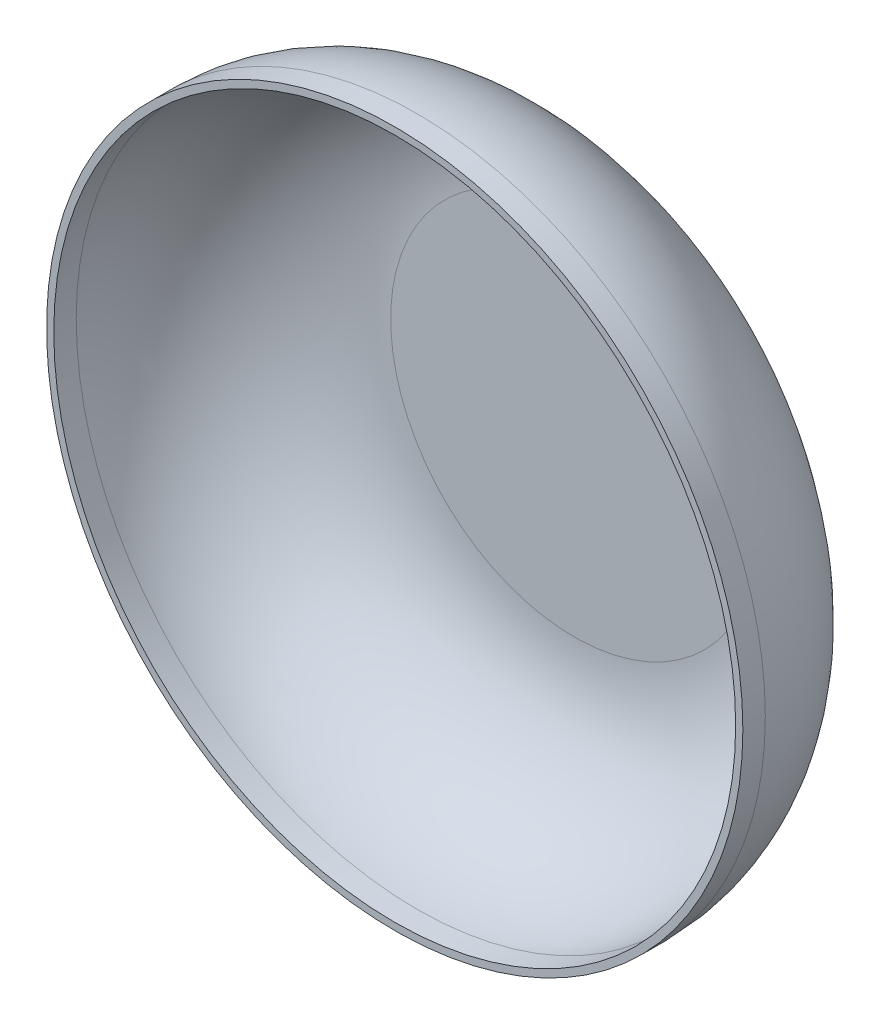
from build123d import *


with BuildPart() as part:
    # Sketch1 → Revolve1 (revolve)
    with BuildSketch(Plane(origin=(0, 0, 0), x_dir=(1, 0, 0), z_dir=(0, 1, 0))):
        with BuildLine():
            Line((759, 0), (759, 50))
            ThreePointArc((759, 50), (656.487373415, 297.487373415), (409, 400))
            Line((409, 400), (0, 400))
            Line((0, 400), (0, 416))
            Line((0, 416), (409, 416))
            ThreePointArc((409, 416), (667.801081914, 308.801081914), (775, 50))
            Line((775, 50), (775, 0))
            Line((775, 0), (759, 0))
        make_face()
    revolve(axis=Axis((0, 0, 0), (0, 0, -1)))


solid = part.part
